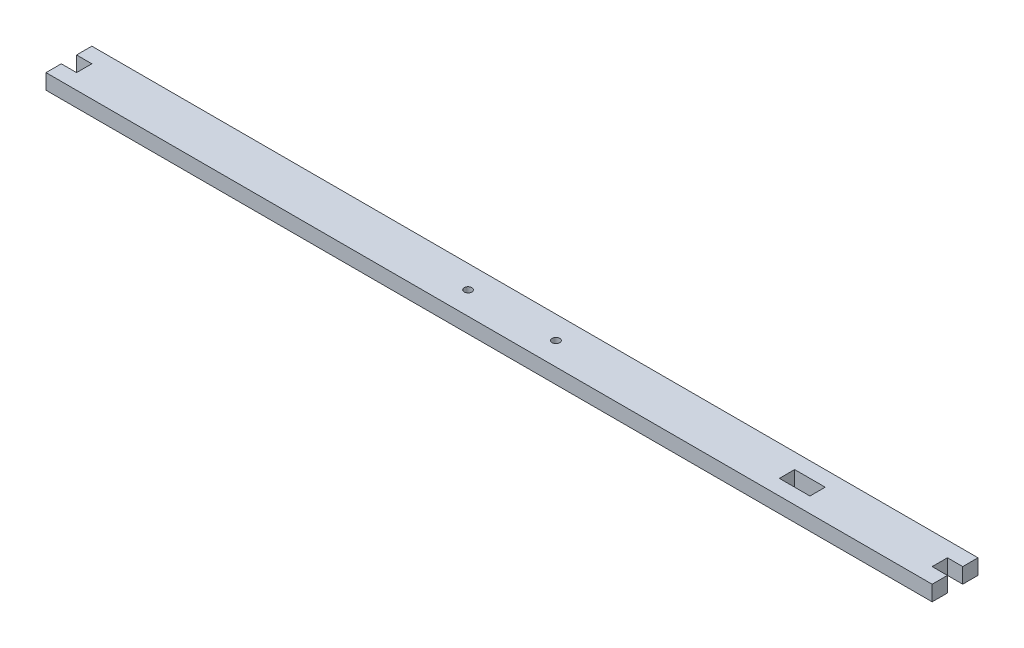
from build123d import *

# Parameters (mm, degrees)
SKETCH1_R           = 1.5875
SKETCH1_W           = 12.7
SKETCH1_H           = 6.35
SKETCH1_W_2         = 6.35
BOSS_EXTRUDE1_DEPTH = 6.35


with BuildPart() as part:
    # Sketch1 → Boss-Extrude1 (new body)
    # profile 1 of 6: a face of its own
    with BuildSketch(Plane(origin=(0, 0, 0), x_dir=(1, 0, 0), z_dir=(0, 1, 0))):
        Polygon((355.6, 19.05), (177.8, 19.05), (177.8, 0), (355.6, 0), (355.6, 6.35), (355.6, 12.7), align=None)
        with Locations(Location((196.05625, 9.525, 0), (0, 0, 270))):
            Circle(SKETCH1_R, mode=Mode.SUBTRACT)
        with Locations((298.45, 9.525)):
            Rectangle(SKETCH1_W, SKETCH1_H, mode=Mode.SUBTRACT)
    # profile 2 of 6: a face of its own
    with BuildSketch(Plane(origin=(0, 0, 0), x_dir=(1, 0, 0), z_dir=(0, 1, 0))):
        Polygon((177.8, 0), (177.8, 19.05), (0, 19.05), (0, 12.7), (0, 6.35), (0, 0), align=None)
        with Locations(Location((159.54375, 9.525, 0), (0, 0, 270))):
            Circle(SKETCH1_R, mode=Mode.SUBTRACT)
    # profile 3 of 6: a face of its own
    with BuildSketch(Plane(origin=(0, 0, 0), x_dir=(1, 0, 0), z_dir=(0, 1, 0))):
        with Locations((-3.175, 15.875)):
            Rectangle(SKETCH1_W_2, SKETCH1_H)
    # profile 4 of 6: a face of its own
    with BuildSketch(Plane(origin=(0, 0, 0), x_dir=(1, 0, 0), z_dir=(0, 1, 0))):
        with Locations((358.775, 15.875)):
            Rectangle(SKETCH1_W_2, SKETCH1_H)
    # profile 5 of 6: a face of its own
    with BuildSketch(Plane(origin=(0, 0, 0), x_dir=(1, 0, 0), z_dir=(0, 1, 0))):
        with Locations((-3.175, 3.175)):
            Rectangle(SKETCH1_W_2, SKETCH1_H)
    # profile 6 of 6: a face of its own
    with BuildSketch(Plane(origin=(0, 0, 0), x_dir=(1, 0, 0), z_dir=(0, 1, 0))):
        with Locations((358.775, 3.175)):
            Rectangle(SKETCH1_W_2, SKETCH1_H)
    extrude(amount=BOSS_EXTRUDE1_DEPTH)


solid = part.part
